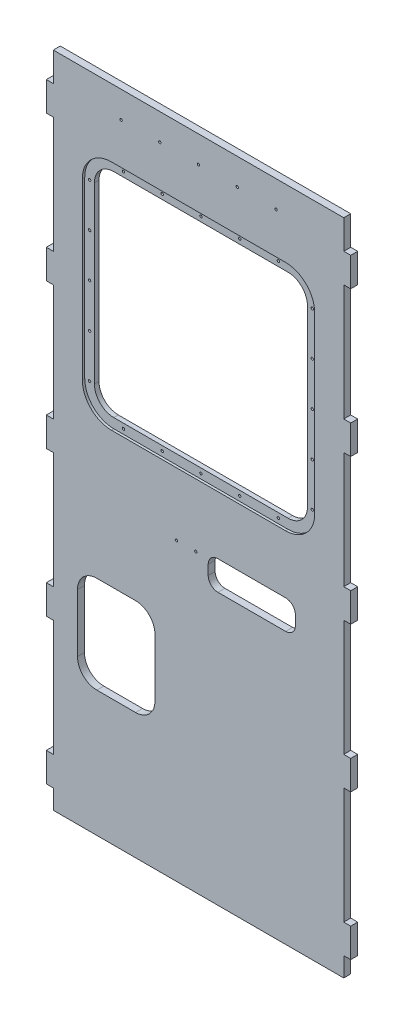
from build123d import *

# Parameters (mm, degrees)
SKETCH2_W               = 381
SKETCH2_H               = 1727.2
BOSS_EXTRUDE1_DEPTH     = 18.288
SKETCH3_W               = 18.288
SKETCH3_H               = 76.2
BOSS_EXTRUDE2_DEPTH     = 18.288
LPATTERN1_COUNT         = 5
LPATTERN1_PITCH         = 381
MIRROR1_COPY_1_SKETCH_W = 18.288
MIRROR1_COPY_1_SKETCH_H = 76.2
MIRROR1_COPY_1_DEPTH    = 18.288
MIRROR1_COPY_2_SKETCH_W = 18.288
MIRROR1_COPY_2_SKETCH_H = 76.2
MIRROR1_COPY_2_DEPTH    = 18.288
MIRROR1_COPY_3_SKETCH_W = 18.288
MIRROR1_COPY_3_SKETCH_H = 76.2
MIRROR1_COPY_3_DEPTH    = 18.288
MIRROR1_COPY_4_SKETCH_W = 18.288
MIRROR1_COPY_4_SKETCH_H = 76.2
MIRROR1_COPY_4_DEPTH    = 18.288
CUT_EXTRUDE2_DEPTH      = 1896.363726014
CUT_EXTRUDE4_DEPTH      = 6.35
SKETCH6_W               = 203.2
SKETCH6_H               = 254
CUT_EXTRUDE5_DEPTH      = 1896.363726014
SKETCH7_R               = 3.175
CUT_EXTRUDE6_DEPTH      = 25.4
FILLET1_R               = 50.8
SKETCH10_W              = 228.6
SKETCH10_H              = 76.2
CUT_EXTRUDE7_DEPTH      = 25.4
FILLET2_R               = 25.4
SKETCH12_R              = 3.175
CUT_EXTRUDE10_DEPTH     = 1896.363726014
SKETCH13_R              = 3.175
CUT_EXTRUDE11_DEPTH     = 1896.363726014


with BuildPart() as part:
    # Sketch2 → Boss-Extrude1 (new body)
    with BuildSketch(Plane.XY):
        with Locations((190.5, 863.6)):
            Rectangle(SKETCH2_W, SKETCH2_H)
    boss_extrude1 = extrude(amount=-BOSS_EXTRUDE1_DEPTH)

    # Sketch3 → Boss-Extrude2 (add)
    with BuildSketch(Plane.XY):
        with Locations((-9.144, 88.9)):
            Rectangle(SKETCH3_W, SKETCH3_H)
    boss_extrude2 = extrude(amount=-BOSS_EXTRUDE2_DEPTH)

    # LPattern1: Boss-Extrude2 ×5
    with Locations(*[(0, i * LPATTERN1_PITCH, 0) for i in range(1, LPATTERN1_COUNT)]):
        add(boss_extrude2)

    # Mirror1: Boss-Extrude1, Boss-Extrude2 across plane
    add(boss_extrude1.mirror(Plane(origin=(381, 0, -18.288), x_dir=(0, 0, 1), z_dir=(1, 0, 0))))
    add(boss_extrude2.mirror(Plane(origin=(381, 0, -18.288), x_dir=(0, 0, 1), z_dir=(1, 0, 0))))

    # Mirror1 copy 1 sketch → Mirror1 copy 1 (add)
    with BuildSketch(Plane(origin=(762, 381, 0), x_dir=(-1, 0, 0), z_dir=(0, 0, 1))):
        with Locations((-9.144, -88.9)):
            Rectangle(MIRROR1_COPY_1_SKETCH_W, MIRROR1_COPY_1_SKETCH_H)
    extrude(amount=-MIRROR1_COPY_1_DEPTH)

    # Mirror1 copy 2 sketch → Mirror1 copy 2 (add)
    with BuildSketch(Plane(origin=(762, 762, 0), x_dir=(-1, 0, 0), z_dir=(0, 0, 1))):
        with Locations((-9.144, -88.9)):
            Rectangle(MIRROR1_COPY_2_SKETCH_W, MIRROR1_COPY_2_SKETCH_H)
    extrude(amount=-MIRROR1_COPY_2_DEPTH)

    # Mirror1 copy 3 sketch → Mirror1 copy 3 (add)
    with BuildSketch(Plane(origin=(762, 1143, 0), x_dir=(-1, 0, 0), z_dir=(0, 0, 1))):
        with Locations((-9.144, -88.9)):
            Rectangle(MIRROR1_COPY_3_SKETCH_W, MIRROR1_COPY_3_SKETCH_H)
    extrude(amount=-MIRROR1_COPY_3_DEPTH)

    # Mirror1 copy 4 sketch → Mirror1 copy 4 (add)
    with BuildSketch(Plane(origin=(762, 1524, 0), x_dir=(-1, 0, 0), z_dir=(0, 0, 1))):
        with Locations((-9.144, -88.9)):
            Rectangle(MIRROR1_COPY_4_SKETCH_W, MIRROR1_COPY_4_SKETCH_H)
    extrude(amount=-MIRROR1_COPY_4_DEPTH)

    # Sketch4 → Cut-Extrude2 (cut, through all)
    with BuildSketch(Plane.XY):
        with BuildLine():
            Line((152.4, 1524), (609.6, 1524))
            ThreePointArc((609.6, 1524), (645.521024484, 1509.121024484), (660.4, 1473.2))
            Line((660.4, 1473.2), (660.4, 1016))
            ThreePointArc((660.4, 1016), (645.521024484, 980.078975516), (609.6, 965.2))
            Line((609.6, 965.2), (152.4, 965.2))
            ThreePointArc((152.4, 965.2), (116.478975516, 980.078975516), (101.6, 1016))
            Line((101.6, 1016), (101.6, 1473.2))
            ThreePointArc((101.6, 1473.2), (116.478975516, 1509.121024484), (152.4, 1524))
        make_face()
    extrude(amount=-CUT_EXTRUDE2_DEPTH, mode=Mode.SUBTRACT)

    # Sketch5 → Cut-Extrude4 (cut)
    with BuildSketch(Plane.XY):
        with BuildLine():
            Line((152.4, 1549.4), (609.6, 1549.4))
            ThreePointArc((609.6, 1549.4), (663.481536726, 1527.081536726), (685.8, 1473.2))
            Line((685.8, 1473.2), (685.8, 1016))
            ThreePointArc((685.8, 1016), (663.481536726, 962.118463274), (609.6, 939.8))
            Line((609.6, 939.8), (152.4, 939.8))
            ThreePointArc((152.4, 939.8), (98.518463274, 962.118463274), (76.2, 1016))
            Line((76.2, 1016), (76.2, 1473.2))
            ThreePointArc((76.2, 1473.2), (98.518463274, 1527.081536726), (152.4, 1549.4))
        make_face()
        with BuildLine():
            Line((152.4, 1524), (609.6, 1524))
            ThreePointArc((609.6, 1524), (645.521024484, 1509.121024484), (660.4, 1473.2))
            Line((660.4, 1473.2), (660.4, 1016))
            ThreePointArc((660.4, 1016), (645.521024484, 980.078975516), (609.6, 965.2))
            Line((609.6, 965.2), (152.4, 965.2))
            ThreePointArc((152.4, 965.2), (116.478975516, 980.078975516), (101.6, 1016))
            Line((101.6, 1016), (101.6, 1473.2))
            ThreePointArc((101.6, 1473.2), (116.478975516, 1509.121024484), (152.4, 1524))
        make_face(mode=Mode.SUBTRACT)
    extrude(amount=-CUT_EXTRUDE4_DEPTH, mode=Mode.SUBTRACT)

    # Sketch6 → Cut-Extrude5 (cut, through all)
    with BuildSketch(Plane.XY):
        with Locations((165.1, 457.2)):
            Rectangle(SKETCH6_W, SKETCH6_H)
    extrude(amount=-CUT_EXTRUDE5_DEPTH, mode=Mode.SUBTRACT)

    # Sketch7 → Cut-Extrude6 (cut)
    with BuildSketch(Plane.XY.offset(-6.35)):
        with Locations((381, 952.5)):
            Circle(SKETCH7_R)
        with Locations((482.6, 952.5)):
            Circle(SKETCH7_R)
        with Locations((584.2, 952.5)):
            Circle(SKETCH7_R)
        with Locations(Location((177.8, 952.5, 0), (0, 0, 180))):
            Circle(SKETCH7_R)
        with Locations(Location((279.4, 952.5, 0), (0, 0, 180))):
            Circle(SKETCH7_R)
        with Locations(Location((584.2, 1536.7, 0), (0, 0, 180))):
            Circle(SKETCH7_R)
        with Locations(Location((482.6, 1536.7, 0), (0, 0, 180))):
            Circle(SKETCH7_R)
        with Locations(Location((381, 1536.7, 0), (0, 0, 180))):
            Circle(SKETCH7_R)
        with Locations((279.4, 1536.7)):
            Circle(SKETCH7_R)
        with Locations((177.8, 1536.7)):
            Circle(SKETCH7_R)
        with Locations((673.1, 1244.832930671)):
            Circle(SKETCH7_R)
        with Locations((673.1, 1359.132930671)):
            Circle(SKETCH7_R)
        with Locations((673.1, 1473.432930671)):
            Circle(SKETCH7_R)
        with Locations((673.1, 1130.532930671)):
            Circle(SKETCH7_R)
        with Locations((673.1, 1016.232930671)):
            Circle(SKETCH7_R)
        with Locations(Location((88.9, 1016.232930671, 0), (0, 0, 180))):
            Circle(SKETCH7_R)
        with Locations(Location((88.9, 1130.532930671, 0), (0, 0, 180))):
            Circle(SKETCH7_R)
        with Locations(Location((88.9, 1244.832930671, 0), (0, 0, 180))):
            Circle(SKETCH7_R)
        with Locations(Location((88.9, 1359.132930671, 0), (0, 0, 180))):
            Circle(SKETCH7_R)
        with Locations(Location((88.9, 1473.432930671, 0), (0, 0, 180))):
            Circle(SKETCH7_R)
        with BuildLine():
            Line((152.4, 965.2), (609.6, 965.2))
            ThreePointArc((609.6, 965.2), (645.521024484, 980.078975516), (660.4, 1016))
            Line((660.4, 1016), (660.4, 1473.2))
            ThreePointArc((660.4, 1473.2), (645.521024484, 1509.121024484), (609.6, 1524))
            Line((609.6, 1524), (152.4, 1524))
            ThreePointArc((152.4, 1524), (116.478975516, 1509.121024484), (101.6, 1473.2))
            Line((101.6, 1473.2), (101.6, 1016))
            ThreePointArc((101.6, 1016), (116.478975516, 980.078975516), (152.4, 965.2))
        make_face()
    extrude(amount=-CUT_EXTRUDE6_DEPTH, mode=Mode.SUBTRACT)

    # Fillet1
    fillet1_edges = [part.edges().sort_by_distance(p)[0] for p in [
        (63.5, 330.2, -9.144),
        (63.5, 584.2, -9.144),
        (266.7, 584.2, -9.144),
        (266.7, 330.2, -9.144),
    ]]
    fillet(fillet1_edges, radius=FILLET1_R)

    # Sketch10 → Cut-Extrude7 (cut)
    with BuildSketch(Plane.XY):
        with Locations((520.7, 749.3)):
            Rectangle(SKETCH10_W, SKETCH10_H)
    extrude(amount=-CUT_EXTRUDE7_DEPTH, mode=Mode.SUBTRACT)

    # Fillet2
    fillet2_edges = [part.edges().sort_by_distance(p)[0] for p in [
        (406.4, 711.2, -9.144),
        (406.4, 787.4, -9.144),
        (635, 787.4, -9.144),
        (635, 711.2, -9.144),
    ]]
    fillet(fillet2_edges, radius=FILLET2_R)

    # Sketch12 → Cut-Extrude10 (cut, through all)
    with BuildSketch(Plane(origin=(0, 0, -18.288), x_dir=(-1, 0, 0), z_dir=(0, 0, -1))):
        with Locations((-584.2, 1657.35)):
            Circle(SKETCH12_R)
        with Locations((-482.6, 1657.35)):
            Circle(SKETCH12_R)
        with Locations((-381, 1657.35)):
            Circle(SKETCH12_R)
        with Locations((-279.4, 1657.35)):
            Circle(SKETCH12_R)
        with Locations((-177.8, 1657.35)):
            Circle(SKETCH12_R)
    extrude(amount=-CUT_EXTRUDE10_DEPTH, mode=Mode.SUBTRACT)

    # Sketch13 → Cut-Extrude11 (cut, through all)
    with BuildSketch(Plane(origin=(0, 0, -18.288), x_dir=(-1, 0, 0), z_dir=(0, 0, -1))):
        with Locations((-373.888, 774.7)):
            Circle(SKETCH13_R)
        with Locations((-323.088, 774.7)):
            Circle(SKETCH13_R)
    extrude(amount=-CUT_EXTRUDE11_DEPTH, mode=Mode.SUBTRACT)


solid = part.part
